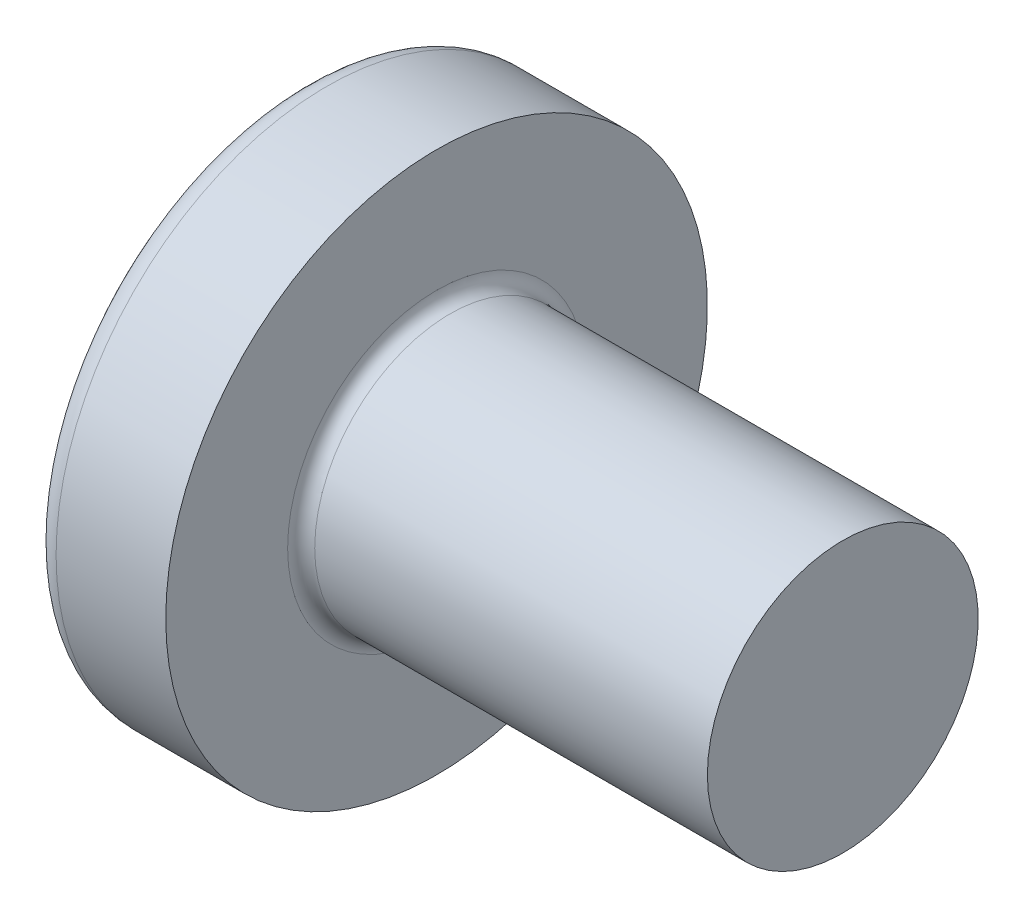
from build123d import *

# Parameters (mm, degrees)
FILLET1_R    = 0.1
RECPAT_COUNT = 2
RECPAT_ANGLE = 90


with BuildPart() as part:
    # BodySke → Base-Revolve (revolve)
    with BuildSketch(Plane.XY, mode=Mode.PRIVATE) as base_revolve_sk:
        with BuildLine():
            Line((1.6, 1), (1.6, 2))
            Line((1.6, 2), (0.790020747, 2))
            ThreePointArc((0.790020747, 2), (0.709789294, 1.981130115), (0.646379599, 1.928476821))
            ThreePointArc((0.646379599, 1.928476821), (0.165895084, 1.016959861), (0, 0))
            Line((0, 0), (4.6, 0))
            Line((4.6, 0), (4.6, 1))
            Line((4.6, 1), (1.6, 1))
        make_face()
    revolve(base_revolve_sk.sketch.rotate(Axis((0.790020747, 0, 0), (1, 0, 0)), 90), axis=Axis((0.790020747, 0, 0), (1, 0, 0)))

    # Fillet1
    fillet1_edges = [part.edges().sort_by_distance(p)[0] for p in [
        (1.6, 0, -1),
    ]]
    fillet(fillet1_edges, radius=FILLET1_R)

    # Sketch3 → Recess section 0
    with BuildSketch(Plane(origin=(0, 0, 0), x_dir=(0, 0, -1), z_dir=(1, 0, 0))):
        with BuildLine():
            Line((0.24, -1.05), (-0.24, -1.05))
            Line((-0.24, -1.05), (-0.24, 1.05))
            Line((-0.24, 1.05), (0.24, 1.05))
            Line((0.24, 1.05), (0.24, -1.05))
        make_face()
    # Sketch4 → Recess section 1
    with BuildSketch(Plane(origin=(1.42, 0, 0), x_dir=(0, 0, -1), z_dir=(1, 0, 0))):
        with BuildLine():
            Line((0.24, -0.342014235), (-0.24, -0.342014235))
            Line((-0.24, -0.342014235), (-0.24, 0.342014235))
            Line((-0.24, 0.342014235), (0.24, 0.342014235))
            Line((0.24, 0.342014235), (0.24, -0.342014235))
        make_face()
    recess = loft(mode=Mode.SUBTRACT)

    # RecPat: Recess ×2 about axis
    recpat_axis = Axis((0, 0, 0), (1, 0, 0))
    for i in range(1, RECPAT_COUNT):
        add(recess.rotate(recpat_axis, i * RECPAT_ANGLE / (RECPAT_COUNT - 1)), mode=Mode.SUBTRACT)

    # RecCorSke → RecessCore (revolve, cut)
    with BuildSketch(Plane.XY, mode=Mode.PRIVATE) as recesscore_sk:
        Polygon((0, 0), (0, 0.454796073), (1.42, 0.3555), (1.535508952, 0), align=None)
    revolve(recesscore_sk.sketch.rotate(Axis((-3.175, 0, 0), (1, 0, 0)), 13.894577695), axis=Axis((-3.175, 0, 0), (1, 0, 0)), mode=Mode.SUBTRACT)


solid = part.part
